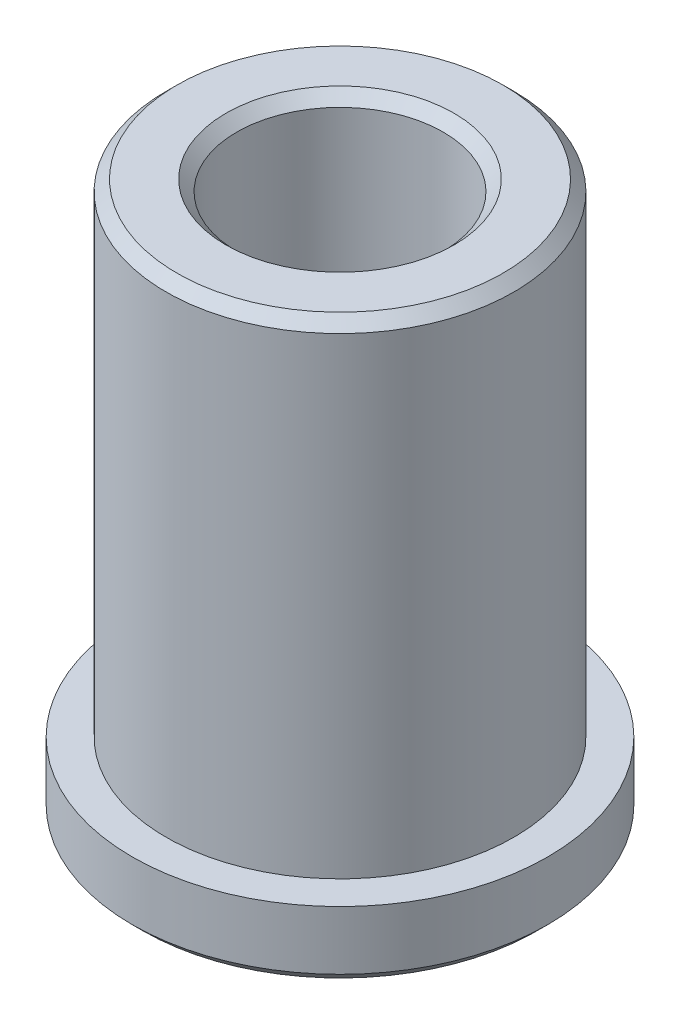
from build123d import *

# Parameters (mm, degrees)
CHAMFER1_SIZE = 0.25


with BuildPart() as part:
    # Sketch1 → Revolve1 (revolve)
    with BuildSketch(Plane.XY, mode=Mode.PRIVATE) as revolve1_sk:
        Polygon((-2.375, 0), (-2.375, 12.7125), (-4, 12.7125), (-4, 1.6), (-4.78, 1.6), (-4.78, 0), align=None)
    revolve(revolve1_sk.sketch.rotate(Axis((0, 0, 0), (0, 1, 0)), 270), axis=Axis((0, 0, 0), (0, 1, 0)))

    # Chamfer1
    chamfer1_edges = [part.edges().sort_by_distance(p)[0] for p in [
        (0, 0, 4.78),
        (0, 12.7125, 4),
        (0, 12.7125, 2.375),
        (0, 0, 2.375),
    ]]
    chamfer(chamfer1_edges, length=CHAMFER1_SIZE)


solid = part.part
